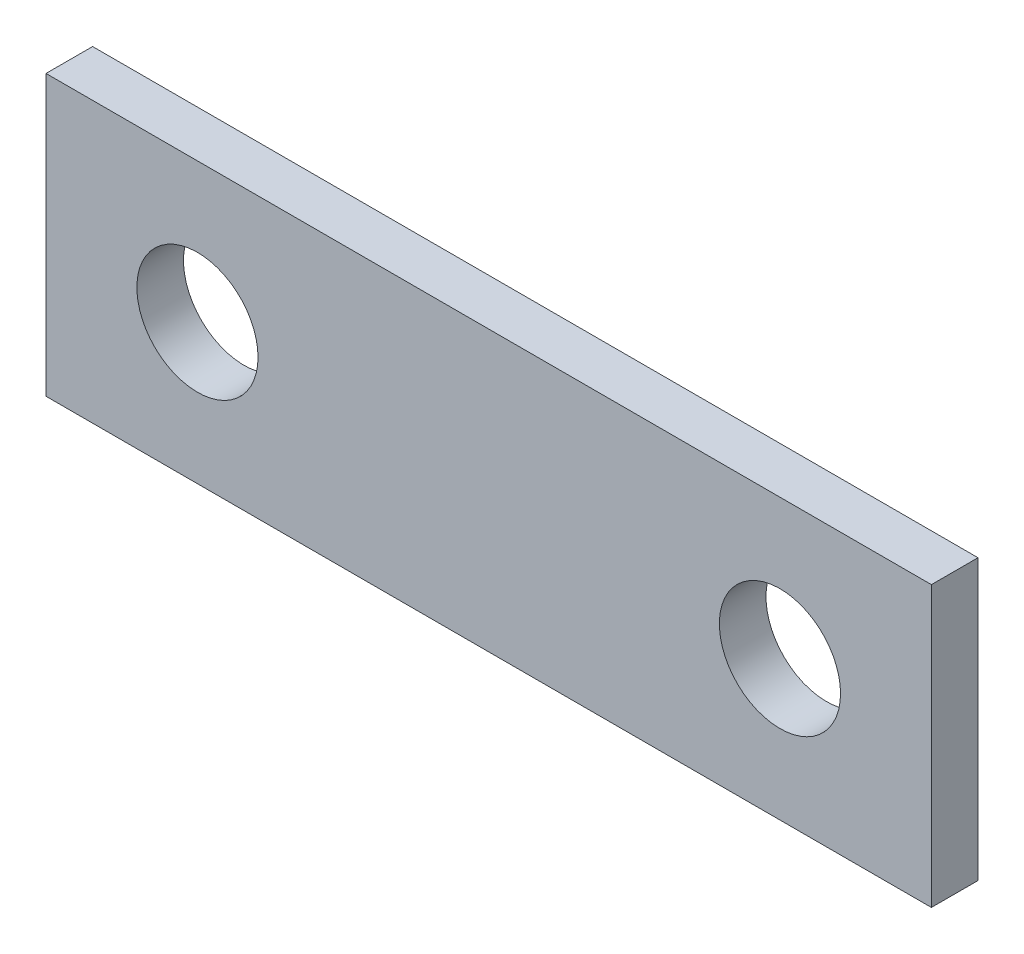
from build123d import *

# Parameters (mm, degrees)
SKETCH_1_W      = 38
SKETCH_1_H      = 12
SKETCH_1_R      = 2.6
EXTRUDE_1_DEPTH = 2


with BuildPart() as part:
    # 草图1 → 凸台-拉伸1 (new body)
    with BuildSketch(Plane.XY):
        Rectangle(SKETCH_1_W, SKETCH_1_H)
        with Locations((12.5, 0)):
            Circle(SKETCH_1_R, mode=Mode.SUBTRACT)
        with Locations((-12.5, 0)):
            Circle(SKETCH_1_R, mode=Mode.SUBTRACT)
    extrude(amount=EXTRUDE_1_DEPTH)


solid = part.part
